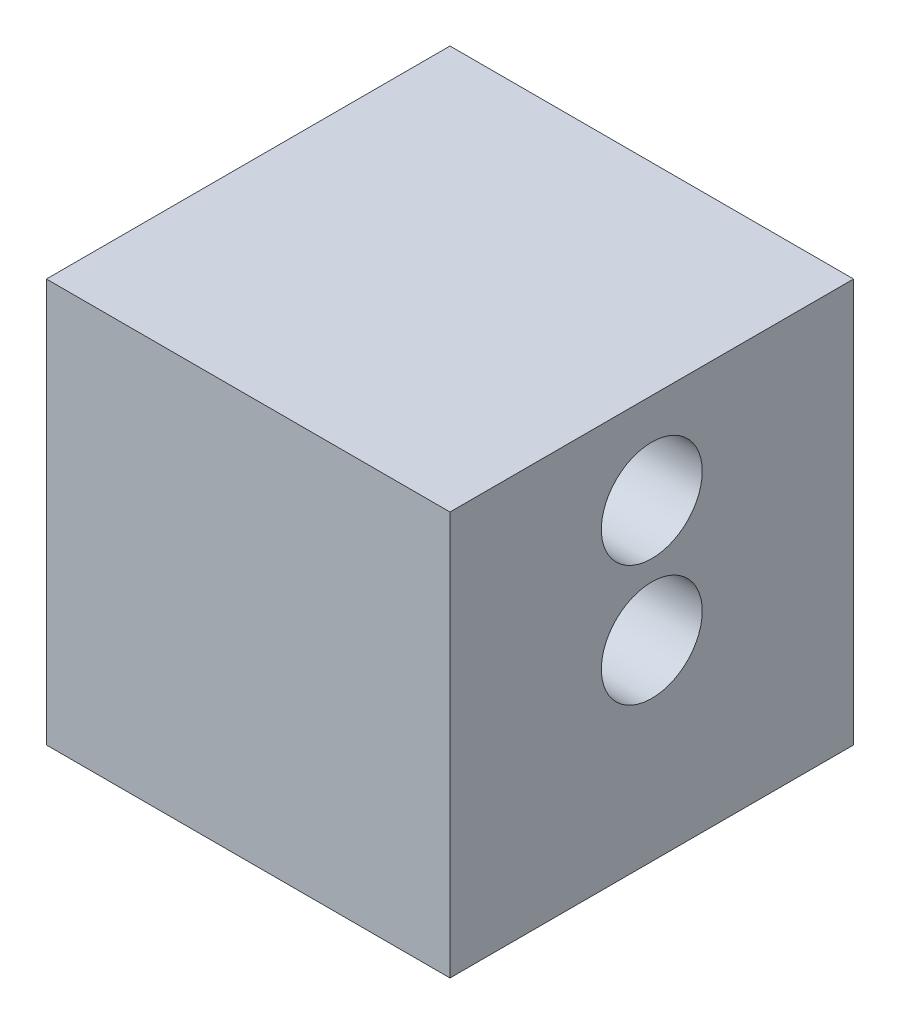
from build123d import *

# Parameters (mm, degrees)
SKETCH1_W           = 20
SKETCH1_H           = 20
BOSS_EXTRUDE1_DEPTH = 20
SKETCH3_R           = 2.5
CUT_EXTRUDE1_DEPTH  = 35.641016151
SKETCH4_R           = 2.5
CUT_EXTRUDE2_DEPTH  = 15


with BuildPart() as part:
    # Sketch1 → Boss-Extrude1 (new body)
    with BuildSketch(Plane(origin=(0, 0, 0), x_dir=(1, 0, 0), z_dir=(0, 1, 0))):
        with Locations((-10, 10)):
            Rectangle(SKETCH1_W, SKETCH1_H)
    extrude(amount=BOSS_EXTRUDE1_DEPTH)

    # Sketch3 → Cut-Extrude1 (cut, through all)
    with BuildSketch(Plane(origin=(0, 0, 0), x_dir=(0, 0, -1), z_dir=(1, 0, 0))):
        with Locations((10, 15.5)):
            Circle(SKETCH3_R)
    extrude(amount=-CUT_EXTRUDE1_DEPTH, mode=Mode.SUBTRACT)

    # Sketch4 → Cut-Extrude2 (cut)
    with BuildSketch(Plane(origin=(0, 0, 0), x_dir=(0, 0, -1), z_dir=(1, 0, 0))):
        with Locations((10, 9.5)):
            Circle(SKETCH4_R)
    extrude(amount=-CUT_EXTRUDE2_DEPTH, mode=Mode.SUBTRACT)


solid = part.part
